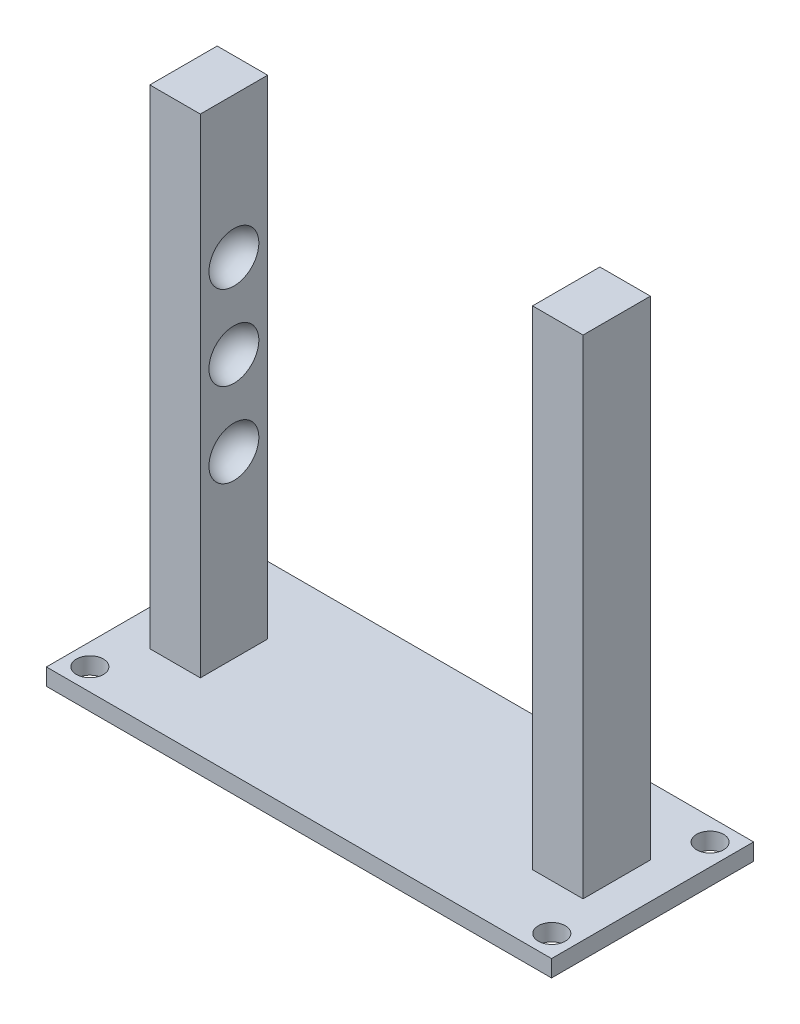
from build123d import *
from build123d.topology import SkipClean

# Parameters (mm, degrees)
SKETCH_2_W                 = 150
SKETCH_2_H                 = 60
EXTRUDE_1_DEPTH            = 5
SKETCH_3_W                 = 15
SKETCH_3_H                 = 20
EXTRUDE_2_DEPTH            = 150
PATTERN_LINEAR_1_COUNT     = 2
PATTERN_LINEAR_1_PITCH     = 25
PATTERN_LINEAR_1_COL_COUNT = 2
PATTERN_LINEAR_1_COL_PITCH = 25
SKETCH_22_R                = 4
CUT_EXTRUDE_3_DEPTH        = 5
MIRROR_19_COPY_1_SKETCH_R  = 4
MIRROR_19_COPY_1_DEPTH     = 5


with BuildPart() as part:
    # 草图2 → 凸台-拉伸1 (new body)
    with BuildSketch(Plane(origin=(0, 0, 0), x_dir=(1, 0, 0), z_dir=(0, 1, 0))):
        with Locations((-40.476378725, 10.538808084)):
            Rectangle(SKETCH_2_W, SKETCH_2_H)
    extrude(amount=EXTRUDE_1_DEPTH)

    # 草图3 → 凸台-拉伸2 (add)
    with BuildSketch(Plane(origin=(0, 0, 0), x_dir=(1, 0, 0), z_dir=(0, 1, 0))):
        with Locations((-97.302512432, 10.572361891)):
            Rectangle(SKETCH_3_W, SKETCH_3_H)
    extrude_2 = extrude(amount=EXTRUDE_2_DEPTH)

    # 草图19 → 切除-旋转29 (revolve, cut)
    with BuildSketch(Plane.XY.offset(-10.538808084)):
        with BuildLine():
            Line((-89.802512432, 90.57618696), (-89.802512432, 75.771839239))
            ThreePointArc((-89.802512432, 75.771839239), (-97.204686292, 83.1740131), (-89.802512432, 90.57618696))
        make_face()
    cut_revolve_29 = revolve(axis=Axis((-89.802512432, 90.57618696, -10.538808084), (0, -1, 0)), mode=Mode.SUBTRACT)

    # 阵列(线性)1: 切除-旋转29 ×2
    with Locations(*[(0, i * PATTERN_LINEAR_1_PITCH, 0) for i in range(1, PATTERN_LINEAR_1_COUNT)]):
        add(cut_revolve_29, mode=Mode.SUBTRACT)

    # 阵列(线性)1 col: 切除-旋转29 ×2
    with Locations(*[(0, -i * PATTERN_LINEAR_1_COL_PITCH, 0) for i in range(1, PATTERN_LINEAR_1_COL_COUNT)]):
        add(cut_revolve_29, mode=Mode.SUBTRACT)

    # 草图22 → 切除-拉伸3 (cut)
    with BuildSketch(Plane(origin=(0, 0, 0), x_dir=(1, 0, 0), z_dir=(0, 1, 0))):
        with Locations(Location((-109.062885819, 34.038808084, 0), (0, 0, 270))):
            Circle(SKETCH_22_R)
    cut_extrude_3 = extrude(amount=CUT_EXTRUDE_3_DEPTH, mode=Mode.SUBTRACT)

    # 镜向18: 切除-拉伸3 across plane
    add(cut_extrude_3.mirror(Plane.XY.offset(-10.538808084)), mode=Mode.SUBTRACT)

    # 镜向19: 切除-拉伸3 across plane
    add(cut_extrude_3.mirror(Plane(origin=(-40.476378725, 0, 0), x_dir=(0, 0, 1), z_dir=(1, 0, 0))), mode=Mode.SUBTRACT)

    # 镜向19 copy 1 sketch → 镜向19 copy 1 (cut)
    with BuildSketch(Plane(origin=(-80.95275745, 0, -21.077616169), x_dir=(-1, 0, 0), z_dir=(0, 1, 0))):
        with Locations(Location((-109.062885819, 34.038808084, 0), (0, 0, 270))):
            Circle(MIRROR_19_COPY_1_SKETCH_R)
    extrude(amount=MIRROR_19_COPY_1_DEPTH, mode=Mode.SUBTRACT)

    # 镜向20: 凸台-拉伸2 across plane
    add(extrude_2.mirror(Plane(origin=(-40.476378725, 0, 0), x_dir=(0, 0, 1), z_dir=(1, 0, 0))))

    # 镜向21: 切除-旋转29 across plane
    with SkipClean():  # the faces are left unmerged after this step: merging them gives an invalid solid
        add(cut_revolve_29.mirror(Plane(origin=(-40.476378725, 0, 0), x_dir=(0, 0, 1), z_dir=(1, 0, 0))), mode=Mode.SUBTRACT)

    # 镜向22 copy 1 sketch → 镜向22 copy 1 (revolve, cut)
    with SkipClean():  # the faces are left unmerged after this step: merging them gives an invalid solid
        with BuildSketch(Plane(origin=(-80.95275745, 25, -10.538808084), x_dir=(-1, 0, 0), z_dir=(0, 0, 1))):
            with BuildLine():
                Line((-89.802512432, -90.57618696), (-89.802512432, -75.771839239))
                ThreePointArc((-89.802512432, -75.771839239), (-97.204686292, -83.1740131), (-89.802512432, -90.57618696))
            make_face()
        revolve(axis=Axis((8.849754981, 115.57618696, -10.538808084), (0, 1, 0)), mode=Mode.SUBTRACT)

    # 镜向22 copy 2 sketch → 镜向22 copy 2 (revolve, cut)
    with SkipClean():  # the faces are left unmerged after this step: merging them gives an invalid solid
        with BuildSketch(Plane(origin=(-80.95275745, -25, -10.538808084), x_dir=(-1, 0, 0), z_dir=(0, 0, 1))):
            with BuildLine():
                Line((-89.802512432, -90.57618696), (-89.802512432, -75.771839239))
                ThreePointArc((-89.802512432, -75.771839239), (-97.204686292, -83.1740131), (-89.802512432, -90.57618696))
            make_face()
        revolve(axis=Axis((8.849754981, 65.57618696, -10.538808084), (0, 1, 0)), mode=Mode.SUBTRACT)

    # 镜向22 copy 3 sketch → 镜向22 copy 3 (revolve, cut)
    with SkipClean():  # the faces are left unmerged after this step: merging them gives an invalid solid
        with BuildSketch(Plane(origin=(-80.95275745, 0, -10.538808084), x_dir=(-1, 0, 0), z_dir=(0, 0, 1))):
            with BuildLine():
                Line((-89.802512432, -90.57618696), (-89.802512432, -75.771839239))
                ThreePointArc((-89.802512432, -75.771839239), (-97.204686292, -83.1740131), (-89.802512432, -90.57618696))
            make_face()
        revolve(axis=Axis((8.849754981, 90.57618696, -10.538808084), (0, 1, 0)), mode=Mode.SUBTRACT)


solid = part.part
